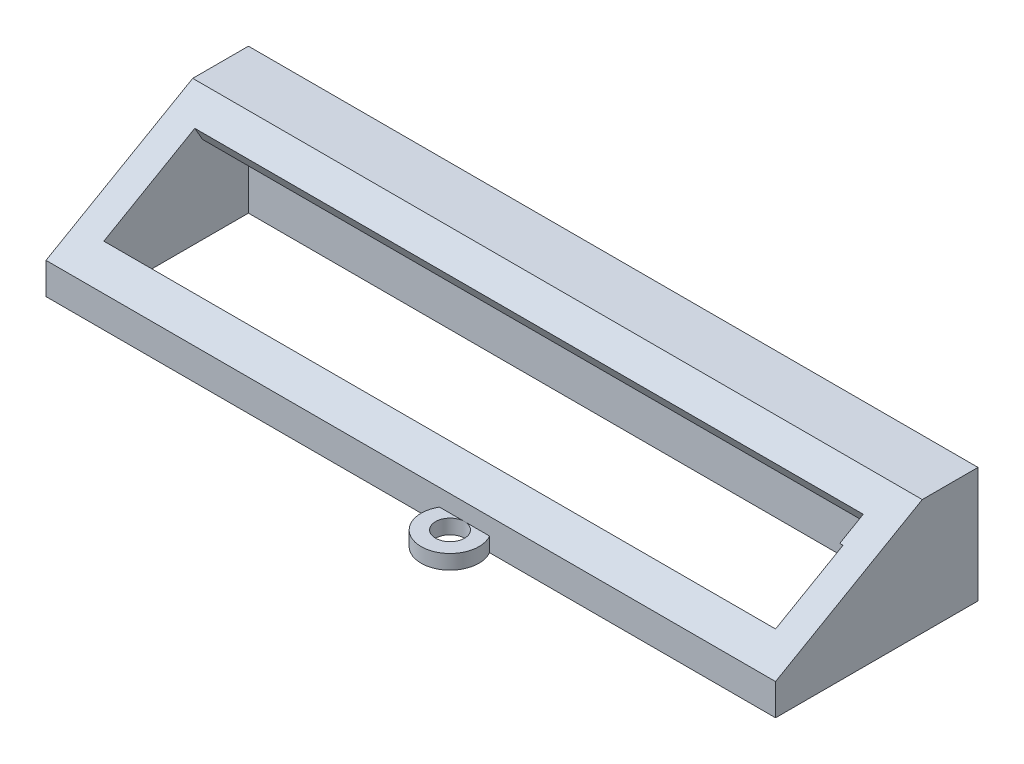
from build123d import *

# Parameters (mm, degrees)
SKETCH_1_W          = 504.54
SKETCH_1_H          = 140
EXTRUDE_1_DEPTH     = 80
SKETCH_2_W          = 464.54
SKETCH_2_H          = 100
CUT_EXTRUDE_1_DEPTH = 60
CUT_EXTRUDE_2_DEPTH = 516.616729364
SKETCH_8_W          = 462.27
SKETCH_8_H          = 18.765324385
CUT_EXTRUDE_3_DEPTH = 15
SKETCH_12_R         = 20
SKETCH_12_R_2       = 10
EXTRUDE_2_DEPTH     = 10


with BuildPart() as part:
    # 草圖1 → 填料-伸長1 (new body)
    with BuildSketch(Plane(origin=(0, 0, 0), x_dir=(1, 0, 0), z_dir=(0, 1, 0))):
        Rectangle(SKETCH_1_W, SKETCH_1_H)
    extrude(amount=EXTRUDE_1_DEPTH)

    # 草圖2 → 除料-伸長1 (cut)
    with BuildSketch(Plane.XZ):
        Rectangle(SKETCH_2_W, SKETCH_2_H)
    extrude(amount=-CUT_EXTRUDE_1_DEPTH, mode=Mode.SUBTRACT)

    # 草圖7 → 除料-伸長2 (cut, through all)
    with BuildSketch(Plane(origin=(252.27, 0, 0), x_dir=(0, 0, -1), z_dir=(1, 0, 0))):
        Polygon((-70, 21.729405289), (31.457073642, 80), (-70, 80), align=None)
    extrude(amount=-CUT_EXTRUDE_2_DEPTH, mode=Mode.SUBTRACT)

    # 草圖8 → 除料-伸長3 (cut)
    with BuildSketch(Plane(origin=(0, 46.570964705, 26.747448081), x_dir=(1, 0, 0), z_dir=(0, 0.8671544755717103, 0.4980392710378893))):
        with Locations((-1.135, 36.346470221)):
            Rectangle(SKETCH_8_W, SKETCH_8_H)
    extrude(amount=-CUT_EXTRUDE_3_DEPTH, mode=Mode.SUBTRACT)

    # 草圖12 → 伸長-薄件2 (add)
    with BuildSketch(Plane.XZ):
        with Locations((37.16174113, 80)):
            Circle(SKETCH_12_R)
        with Locations((37.16174113, 80)):
            Circle(SKETCH_12_R_2, mode=Mode.SUBTRACT)
    extrude(amount=-EXTRUDE_2_DEPTH)


solid = part.part
